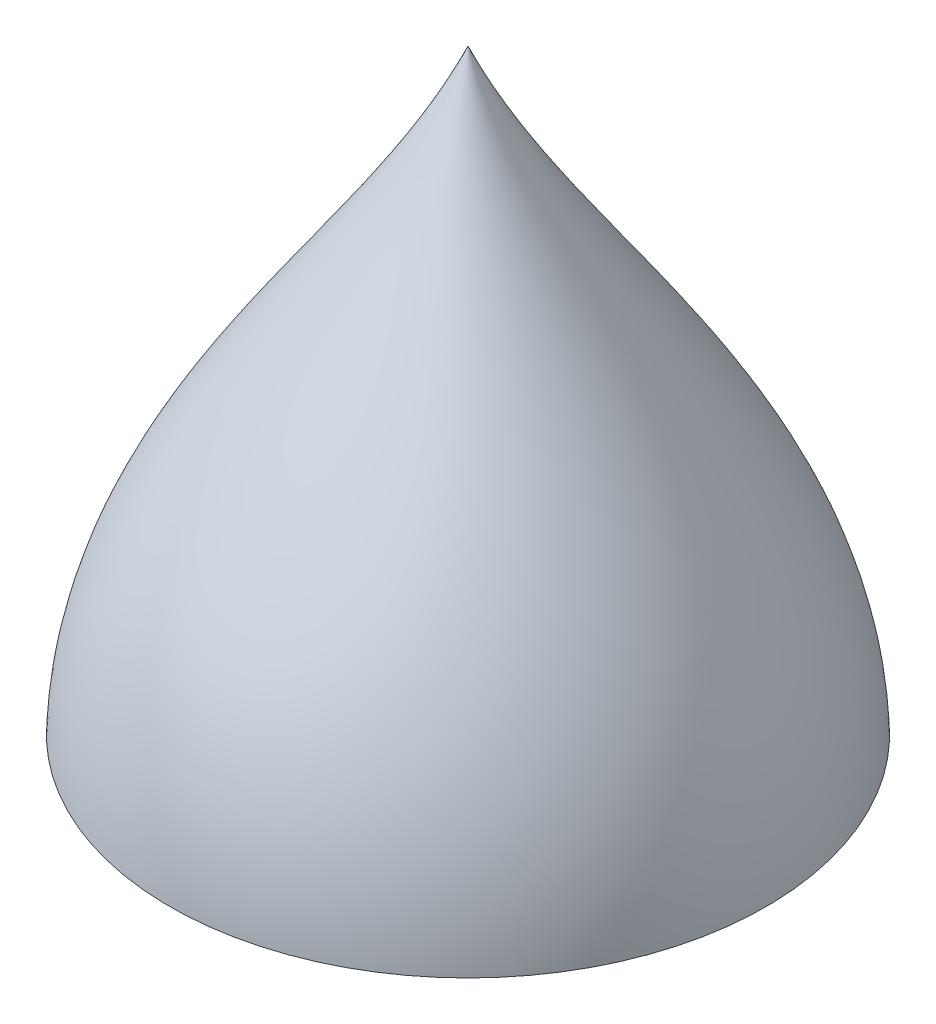
from build123d import *


with BuildPart() as part:
    # Sketch1 → Revolve1 (revolve)
    with BuildSketch(Plane.XY, mode=Mode.PRIVATE) as revolve1_sk:
        with BuildLine():
            Line((-4, 0), (-3.1, 0))
            Line((-3.1, 0), (-3.1, 1))
            Line((-3.1, 1), (-2, 1))
            Line((-2, 1), (-2, 0))
            Line((-2, 0), (0, 0))
            Line((0, 0), (0, 8))
            add(Edge.make_bspline(
                [(-4, 0), (-3.886746614, 3.120071897), (-1.176860552, 5.322927223), (0, 8)],
                knots=[0, 0, 0, 0, 1, 1, 1, 1], degree=3))
        make_face()
    revolve(revolve1_sk.sketch.rotate(Axis((0, 0, 0), (0, 1, 0)), 270), axis=Axis((0, 0, 0), (0, 1, 0)))


solid = part.part
